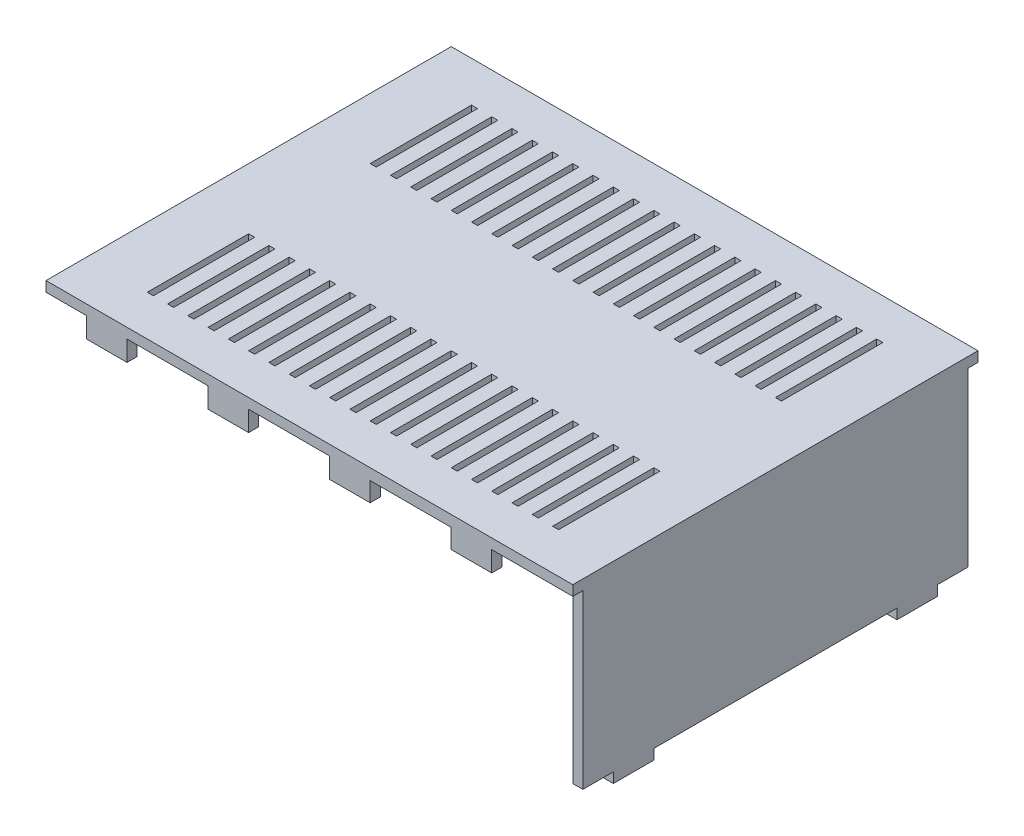
from build123d import *

# Parameters (mm, degrees)
SKETCH2_W            = 130
SKETCH2_H            = 100
BOSS_EXTRUDE3_DEPTH  = 7.5
SKETCH5_W            = 125
SKETCH5_H            = 95
CUT_EXTRUDE1_DEPTH   = 2.5
SKETCH12_W           = 10
SKETCH12_H           = 5
CUT_EXTRUDE7_DEPTH   = 2.5
SKETCH13_W           = 125
SKETCH13_H           = 95
CUT_EXTRUDE8_DEPTH   = 2.5
SKETCH14_W           = 10
SKETCH14_H           = 5
CUT_EXTRUDE9_DEPTH   = 2.5
SKETCH15_W           = 20
SKETCH15_H           = 5
CUT_EXTRUDE10_DEPTH  = 2.5
SKETCH16_W           = 20
SKETCH16_H           = 5
CUT_EXTRUDE11_DEPTH  = 2.5
SKETCH17_W           = 20
SKETCH17_H           = 5
CUT_EXTRUDE12_DEPTH  = 2.5
SKETCH27_W           = 20
SKETCH27_H           = 5
CUT_EXTRUDE22_DEPTH  = 2.5
SKETCH29_W           = 20
SKETCH29_H           = 5
CUT_EXTRUDE23_DEPTH  = 2.5
SKETCH30_W           = 20
SKETCH30_H           = 5
CUT_EXTRUDE24_DEPTH  = 2.5
SKETCH25_W           = 1.5
SKETCH25_H           = 25
CUT_EXTRUDE19_DEPTH  = 2.5
LPATTERN1_COUNT      = 21
LPATTERN1_PITCH      = 5
LPATTERN1_COUNT_DIR2 = 2
LPATTERN1_PITCH_DIR2 = 55
SKETCH26_W           = 20
SKETCH26_H           = 5
CUT_EXTRUDE20_DEPTH  = 2.5
SKETCH31_W           = 20
SKETCH31_H           = 5
CUT_EXTRUDE25_DEPTH  = 2.5
SKETCH32_W           = 2.5
SKETCH32_H           = 95
BOSS_EXTRUDE4_DEPTH  = 40
SKETCH33_W           = 10
SKETCH33_H           = 5
CUT_EXTRUDE26_DEPTH  = 2.5
SKETCH34_W           = 25
SKETCH34_H           = 5
CUT_EXTRUDE29_DEPTH  = 2.5
SKETCH37_W           = 25
SKETCH37_H           = 5
CUT_EXTRUDE30_DEPTH  = 2.5
SKETCH38_W           = 10
SKETCH38_H           = 5
CUT_EXTRUDE31_DEPTH  = 2.5
SKETCH39_W           = 2.5
SKETCH39_H           = 10
CUT_EXTRUDE32_DEPTH  = 2.5
SKETCH40_W           = 2.5
SKETCH40_H           = 10
CUT_EXTRUDE33_DEPTH  = 2.5
SKETCH41_W           = 2.5
SKETCH41_H           = 60
CUT_EXTRUDE35_DEPTH  = 2.5


with BuildPart() as part:
    # Sketch2 → Boss-Extrude3 (new body)
    with BuildSketch(Plane(origin=(0, 0, 0), x_dir=(1, 0, 0), z_dir=(0, 1, 0))):
        Rectangle(SKETCH2_W, SKETCH2_H)
    extrude(amount=BOSS_EXTRUDE3_DEPTH)

    # Sketch5 → Cut-Extrude1 (cut)
    with BuildSketch(Plane.XZ):
        Rectangle(SKETCH5_W, SKETCH5_H)
    extrude(amount=-CUT_EXTRUDE1_DEPTH, mode=Mode.SUBTRACT)

    # Sketch12 → Cut-Extrude7 (cut)
    with BuildSketch(Plane(origin=(0, 0, -50), x_dir=(-1, 0, 0), z_dir=(0, 0, -1))):
        with Locations((60, 2.5)):
            Rectangle(SKETCH12_W, SKETCH12_H)
    extrude(amount=-CUT_EXTRUDE7_DEPTH, mode=Mode.SUBTRACT)

    # Sketch13 → Cut-Extrude8 (cut)
    with BuildSketch(Plane.XZ.offset(-2.5)):
        Rectangle(SKETCH13_W, SKETCH13_H)
    extrude(amount=-CUT_EXTRUDE8_DEPTH, mode=Mode.SUBTRACT)

    # Sketch14 → Cut-Extrude9 (cut)
    with BuildSketch(Plane.XY.offset(50)):
        with Locations((-60, 2.5)):
            Rectangle(SKETCH14_W, SKETCH14_H)
    extrude(amount=-CUT_EXTRUDE9_DEPTH, mode=Mode.SUBTRACT)

    # Sketch15 → Cut-Extrude10 (cut)
    with BuildSketch(Plane.XY.offset(50)):
        with Locations((-35, 2.5)):
            Rectangle(SKETCH15_W, SKETCH15_H)
    extrude(amount=-CUT_EXTRUDE10_DEPTH, mode=Mode.SUBTRACT)

    # Sketch16 → Cut-Extrude11 (cut)
    with BuildSketch(Plane.XY.offset(50)):
        with Locations((-5, 2.5)):
            Rectangle(SKETCH16_W, SKETCH16_H)
    extrude(amount=-CUT_EXTRUDE11_DEPTH, mode=Mode.SUBTRACT)

    # Sketch17 → Cut-Extrude12 (cut)
    with BuildSketch(Plane.XY.offset(50)):
        with Locations((25, 2.247273604)):
            Rectangle(SKETCH17_W, SKETCH17_H)
    extrude(amount=-CUT_EXTRUDE12_DEPTH, mode=Mode.SUBTRACT)

    # Sketch27 → Cut-Extrude22 (cut)
    with BuildSketch(Plane(origin=(0, 0, -50), x_dir=(-1, 0, 0), z_dir=(0, 0, -1))):
        with Locations((35, 2.5)):
            Rectangle(SKETCH27_W, SKETCH27_H)
    extrude(amount=-CUT_EXTRUDE22_DEPTH, mode=Mode.SUBTRACT)

    # Sketch29 → Cut-Extrude23 (cut)
    with BuildSketch(Plane(origin=(0, 0, -50), x_dir=(-1, 0, 0), z_dir=(0, 0, -1))):
        with Locations((5, 2.5)):
            Rectangle(SKETCH29_W, SKETCH29_H)
    extrude(amount=-CUT_EXTRUDE23_DEPTH, mode=Mode.SUBTRACT)

    # Sketch30 → Cut-Extrude24 (cut)
    with BuildSketch(Plane(origin=(0, 0, -50), x_dir=(-1, 0, 0), z_dir=(0, 0, -1))):
        with Locations((-25, 2.5)):
            Rectangle(SKETCH30_W, SKETCH30_H)
    extrude(amount=-CUT_EXTRUDE24_DEPTH, mode=Mode.SUBTRACT)

    # Sketch25 → Cut-Extrude19 (cut)
    with BuildSketch(Plane(origin=(0, 7.5, 0), x_dir=(1, 0, 0), z_dir=(0, 1, 0))):
        with Locations((-49.25, 27.5)):
            Rectangle(SKETCH25_W, SKETCH25_H)
    cut_extrude19 = extrude(amount=-CUT_EXTRUDE19_DEPTH, mode=Mode.SUBTRACT)

    # LPattern1: Cut-Extrude19 21 × 2
    with Locations(*[(i * LPATTERN1_PITCH, 0, j * LPATTERN1_PITCH_DIR2) for i in range(LPATTERN1_COUNT) for j in range(LPATTERN1_COUNT_DIR2) if (i, j) != (0, 0)]):
        add(cut_extrude19, mode=Mode.SUBTRACT)

    # Sketch26 → Cut-Extrude20 (cut)
    with BuildSketch(Plane.XY.offset(50)):
        with Locations((55, 2.5)):
            Rectangle(SKETCH26_W, SKETCH26_H)
    extrude(amount=-CUT_EXTRUDE20_DEPTH, mode=Mode.SUBTRACT)

    # Sketch31 → Cut-Extrude25 (cut)
    with BuildSketch(Plane(origin=(0, 0, -50), x_dir=(-1, 0, 0), z_dir=(0, 0, -1))):
        with Locations((-55, 2.5)):
            Rectangle(SKETCH31_W, SKETCH31_H)
    extrude(amount=-CUT_EXTRUDE25_DEPTH, mode=Mode.SUBTRACT)

    # Sketch32 → Boss-Extrude4 (add)
    with BuildSketch(Plane.XZ):
        with Locations((63.75, 0)):
            Rectangle(SKETCH32_W, SKETCH32_H)
    extrude(amount=BOSS_EXTRUDE4_DEPTH)

    # Sketch33 → Cut-Extrude26 (cut)
    with BuildSketch(Plane.ZY.offset(65)):
        with Locations((-45, 2.5)):
            Rectangle(SKETCH33_W, SKETCH33_H)
    extrude(amount=-CUT_EXTRUDE26_DEPTH, mode=Mode.SUBTRACT)

    # Sketch34 → Cut-Extrude29 (cut)
    with BuildSketch(Plane.ZY.offset(65)):
        with Locations((-17.5, 2.5)):
            Rectangle(SKETCH34_W, SKETCH34_H)
    extrude(amount=-CUT_EXTRUDE29_DEPTH, mode=Mode.SUBTRACT)

    # Sketch37 → Cut-Extrude30 (cut)
    with BuildSketch(Plane.ZY.offset(65)):
        with Locations((17.5, 2.5)):
            Rectangle(SKETCH37_W, SKETCH37_H)
    extrude(amount=-CUT_EXTRUDE30_DEPTH, mode=Mode.SUBTRACT)

    # Sketch38 → Cut-Extrude31 (cut)
    with BuildSketch(Plane.ZY.offset(65)):
        with Locations((45, 2.5)):
            Rectangle(SKETCH38_W, SKETCH38_H)
    extrude(amount=-CUT_EXTRUDE31_DEPTH, mode=Mode.SUBTRACT)

    # Sketch39 → Cut-Extrude32 (cut)
    with BuildSketch(Plane.XZ.offset(40)):
        with Locations((63.75, -45)):
            Rectangle(SKETCH39_W, SKETCH39_H)
    extrude(amount=-CUT_EXTRUDE32_DEPTH, mode=Mode.SUBTRACT)

    # Sketch40 → Cut-Extrude33 (cut)
    with BuildSketch(Plane.XZ.offset(40)):
        with Locations((63.75, 45)):
            Rectangle(SKETCH40_W, SKETCH40_H)
    extrude(amount=-CUT_EXTRUDE33_DEPTH, mode=Mode.SUBTRACT)

    # Sketch41 → Cut-Extrude35 (cut)
    with BuildSketch(Plane.XZ.offset(40)):
        with Locations((63.75, 0)):
            Rectangle(SKETCH41_W, SKETCH41_H)
    extrude(amount=-CUT_EXTRUDE35_DEPTH, mode=Mode.SUBTRACT)


solid = part.part
